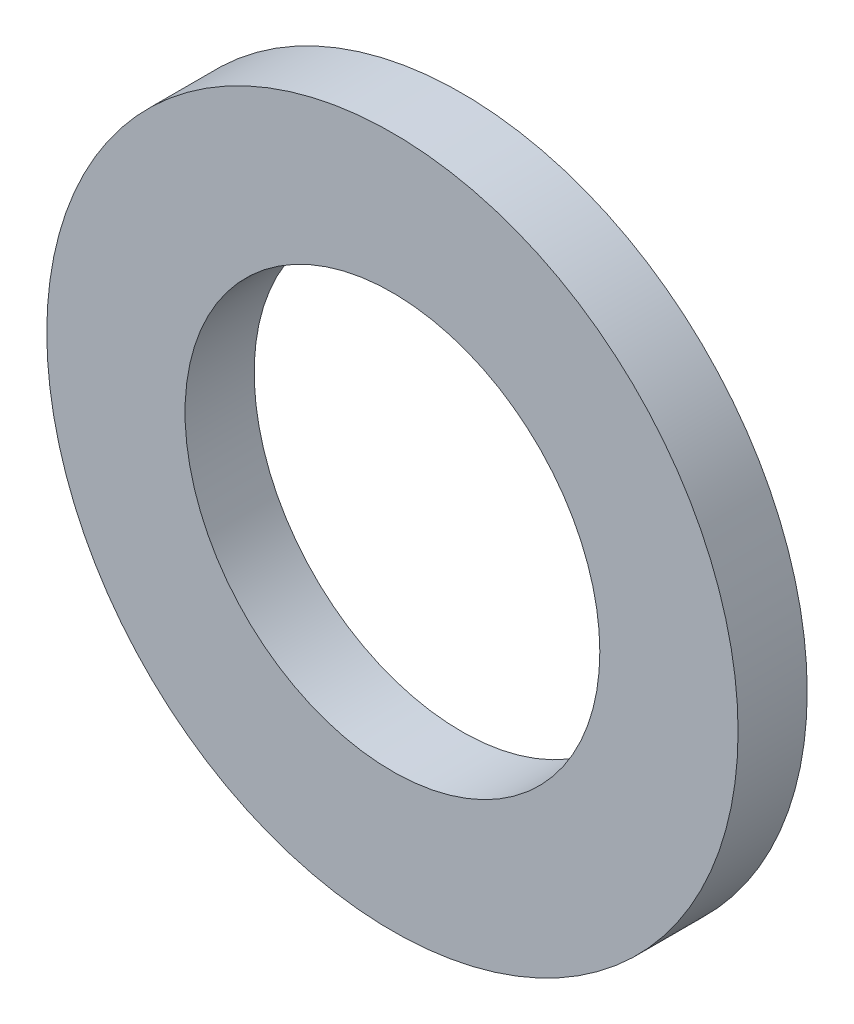
from build123d import *

# Parameters (mm, degrees)
SKETCH1_R           = 25.4
SKETCH1_R_2         = 15.24
BOSS_EXTRUDE1_DEPTH = 5.08


with BuildPart() as part:
    # Sketch1 → Boss-Extrude1 (new body)
    with BuildSketch(Plane.XY):
        Circle(SKETCH1_R)
        Circle(SKETCH1_R_2, mode=Mode.SUBTRACT)
    extrude(amount=BOSS_EXTRUDE1_DEPTH)


solid = part.part
